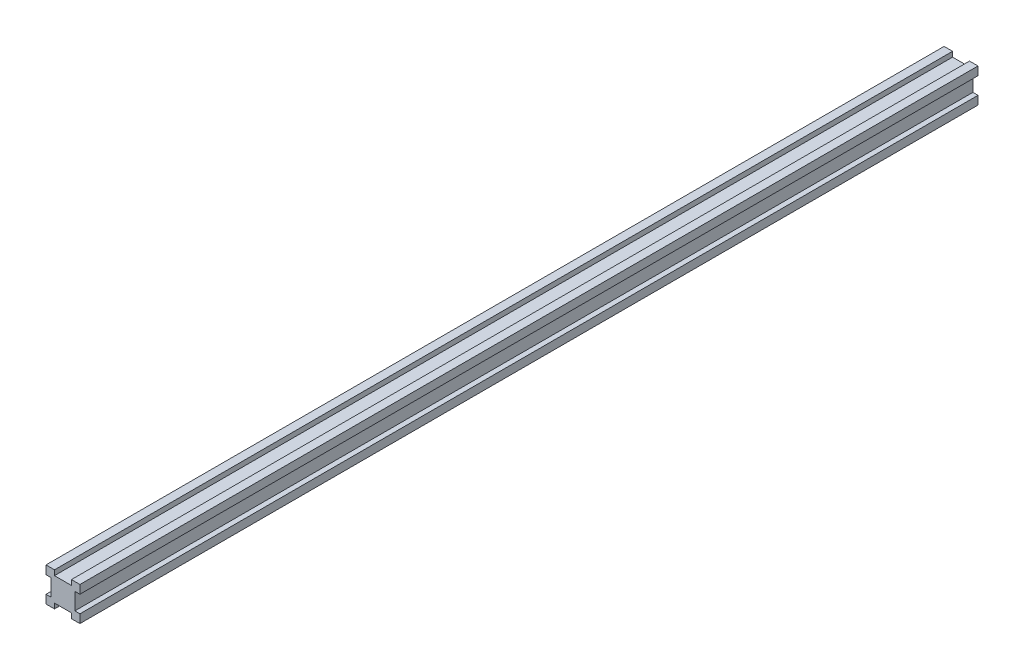
from build123d import *

# Parameters (mm, degrees)
EXTRUDE_1_DEPTH = 265


with BuildPart() as part:
    # 草图1 → 凸台-拉伸1 (new, symmetric)
    with BuildSketch(Plane.XY):
        Polygon((-5, 7), (-5, 10), (-10, 10), (-10, 5), (-7, 5), (-7, -5), (-10, -5), (-10, -10), (-5, -10), (-5, -7), (5, -7), (5, -10), (10, -10), (10, -5), (7, -5), (7, 5), (10, 5), (10, 10), (5, 10), (5, 7), align=None)
    extrude(amount=EXTRUDE_1_DEPTH, both=True)


solid = part.part
